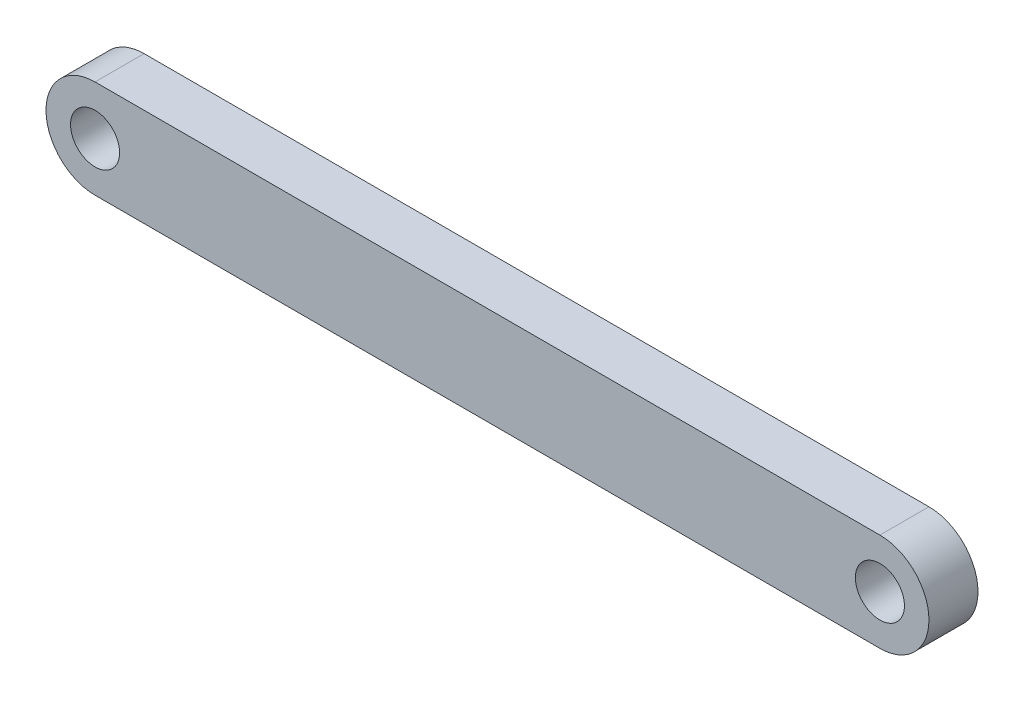
from build123d import *

# Parameters (mm, degrees)
SKETCH2_R           = 2.5
BOSS_EXTRUDE1_DEPTH = 5


with BuildPart() as part:
    # Sketch2 → Boss-Extrude1 (new body)
    with BuildSketch(Plane.XY):
        with BuildLine():
            Line((-47.964450024, 5), (32.035549976, 5))
            ThreePointArc((32.035549976, 5), (37.035549976, 0), (32.035549976, -5))
            Line((32.035549976, -5), (-47.964450024, -5))
            ThreePointArc((-47.964450024, -5), (-52.964450024, 0), (-47.964450024, 5))
        make_face()
        with Locations((-47.964450024, 0)):
            Circle(SKETCH2_R, mode=Mode.SUBTRACT)
        with Locations((32.035549976, 0)):
            Circle(SKETCH2_R, mode=Mode.SUBTRACT)
    extrude(amount=BOSS_EXTRUDE1_DEPTH)


solid = part.part
